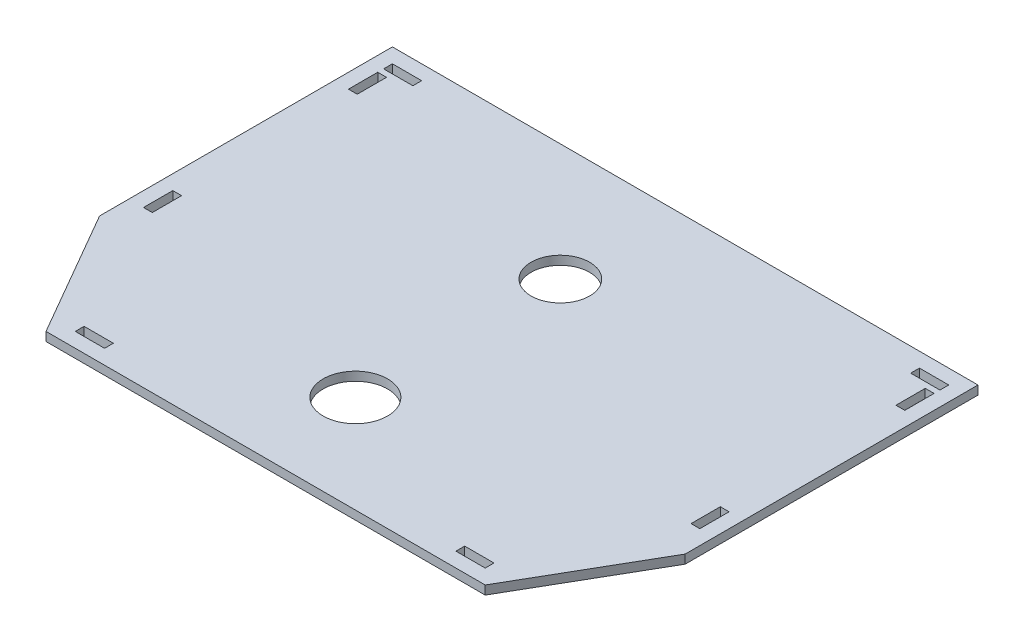
from build123d import *

# Parameters (mm, degrees)
RESSALTO_EXTRUS_O1_DEPTH = 3
ESBO_O3_W                = 10
ESBO_O3_H                = 3
ESBO_O3_W_2              = 3
ESBO_O3_H_2              = 10
ESBO_O3_W_3              = 3.017337907
CORTE_EXTRUS_O1_DEPTH    = 3
ESBO_O5_R                = 10
ESBO_O5_R_2              = 11
CORTE_EXTRUS_O2_DEPTH    = 10


with BuildPart() as part:
    # Esboço1 → Ressalto-extrusão1 (new body)
    with BuildSketch(Plane(origin=(0, 0, 0), x_dir=(1, 0, 0), z_dir=(0, 1, 0))):
        Polygon((-97.357643635, -26.698729811), (-97.357643635, 73.301270189), (102.642356365, 73.301270189), (102.642356365, -26.698729811), (77.642356365, -70), (-72.357643635, -70), align=None)
    extrude(amount=RESSALTO_EXTRUS_O1_DEPTH)

    # Esboço3 → Corte-extrusão1 (cut)
    with BuildSketch(Plane(origin=(0, 3, 0), x_dir=(1, 0, 0), z_dir=(0, 1, 0))):
        with Locations((-62.357643635, -63.5)):
            Rectangle(ESBO_O3_W, ESBO_O3_H)
        with Locations((67.642356365, -63.5)):
            Rectangle(ESBO_O3_W, ESBO_O3_H)
        with Locations((96.142356365, -11.698729811)):
            Rectangle(ESBO_O3_W_2, ESBO_O3_H_2)
        with Locations((96.133687412, 58.301270189)):
            Rectangle(ESBO_O3_W_3, ESBO_O3_H_2)
        with Locations((92.642356365, 66.801270189)):
            Rectangle(ESBO_O3_W, ESBO_O3_H)
        with Locations((-90.857643635, -11.698729811)):
            Rectangle(ESBO_O3_W_2, ESBO_O3_H_2)
        with Locations((-90.857643635, 58.301270189)):
            Rectangle(ESBO_O3_W_2, ESBO_O3_H_2)
        with Locations((-87.357643635, 66.801270189)):
            Rectangle(ESBO_O3_W, ESBO_O3_H)
    extrude(amount=-CORTE_EXTRUS_O1_DEPTH, mode=Mode.SUBTRACT)

    # Esboço5 → Corte-extrusão2 (cut)
    with BuildSketch(Plane(origin=(0, 3, 0), x_dir=(1, 0, 0), z_dir=(0, 1, 0))):
        with Locations(Location((0, 33.301270189, 0), (0, 0, 270))):
            Circle(ESBO_O5_R)
        with Locations(Location((0, -36.698729811, 0), (0, 0, 270))):
            Circle(ESBO_O5_R_2)
    extrude(amount=-CORTE_EXTRUS_O2_DEPTH, mode=Mode.SUBTRACT)


solid = part.part
